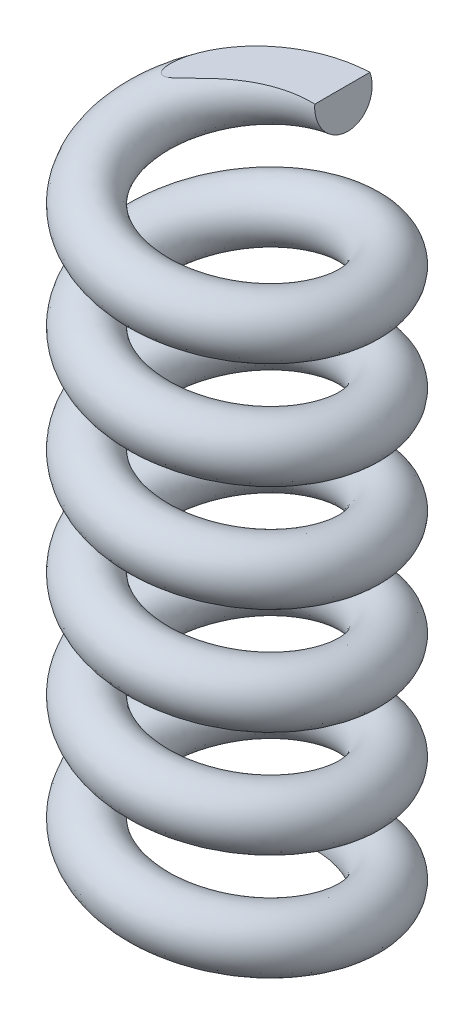
from build123d import *

# Parameters (mm, degrees)
SWEEP4_PITCH       = 15
SWEEP4_HEIGHT      = 90
SWEEP4_RADIUS      = 15
SWEEP4_START_ANGLE = -180
SWEEP4_PROFILE_R   = 4
SKETCH38_R         = 22.075352376
CUT_EXTRUDE1_DEPTH = 10
SKETCH41_R         = 21.050705748
CUT_EXTRUDE5_DEPTH = 10


with BuildPart() as part:
    # Sweep4: sweep along a helix
    with BuildLine() as sweep4_path:
        add(Helix(SWEEP4_PITCH, SWEEP4_HEIGHT, SWEEP4_RADIUS, center=(0, 0, 0), direction=(0, 1, 0), lefthand=True, mode=Mode.PRIVATE).rotate(Axis((0, 0, 0), (0, 1, 0)), SWEEP4_START_ANGLE))
    # Sweep4 profile (on start of the path) → Sweep4 (sweep)
    with BuildSketch(Plane(origin=(0, 0, -15), x_dir=(-0.1571767254779082, 0.9875704921513413, 0), z_dir=(0.9875704921513413, 0.1571767254779082, 8.971125105412251e-13))):
        Circle(SWEEP4_PROFILE_R)
    sweep(path=sweep4_path.line, is_frenet=True)

    # Sketch38 → Cut-Extrude1 (cut)
    with BuildSketch(Plane(origin=(0, 0, 0), x_dir=(1, 0, 0), z_dir=(0, 1, 0))):
        Circle(SKETCH38_R)
    extrude(amount=-CUT_EXTRUDE1_DEPTH, mode=Mode.SUBTRACT)

    # Sketch41 → Cut-Extrude5 (cut)
    with BuildSketch(Plane(origin=(0, 90.93, 0), x_dir=(1, 0, 0), z_dir=(0, 1, 0))):
        Circle(SKETCH41_R)
    extrude(amount=CUT_EXTRUDE5_DEPTH, mode=Mode.SUBTRACT)


solid = part.part
